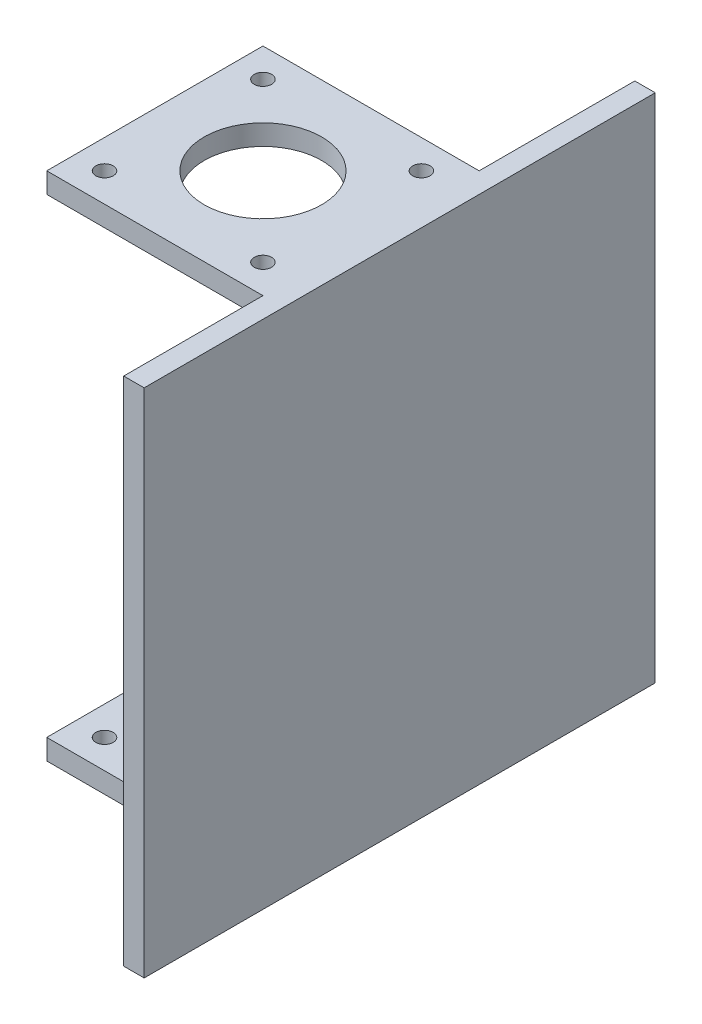
from build123d import *

# Parameters (mm, degrees)
SKETCH2_W           = 42.3
SKETCH2_H           = 42.3
SKETCH2_R           = 1.7
SKETCH2_R_2         = 11.5
BOSS_EXTRUDE1_DEPTH = 4
SKETCH10_W          = 100
SKETCH10_H          = 100
BOSS_EXTRUDE3_DEPTH = 4


with BuildPart() as part:
    # Sketch2 → Boss-Extrude1 (new body)
    with BuildSketch(Plane(origin=(0, 0, 0), x_dir=(1, 0, 0), z_dir=(0, 1, 0))):
        Rectangle(SKETCH2_W, SKETCH2_H)
        with Locations(Location((-15.5, 15.5, 0), (0, 0, 270))):
            Circle(SKETCH2_R, mode=Mode.SUBTRACT)
        with Locations(Location((15.5, 15.5, 0), (0, 0, 270))):
            Circle(SKETCH2_R, mode=Mode.SUBTRACT)
        with Locations(Location((15.5, -15.5, 0), (0, 0, 270))):
            Circle(SKETCH2_R, mode=Mode.SUBTRACT)
        with Locations(Location((-15.5, -15.5, 0), (0, 0, 270))):
            Circle(SKETCH2_R, mode=Mode.SUBTRACT)
        with Locations(Location((0, 0, 0), (0, 0, 270))):
            Circle(SKETCH2_R_2, mode=Mode.SUBTRACT)
    boss_extrude1 = extrude(amount=BOSS_EXTRUDE1_DEPTH)

    # Sketch10 → Boss-Extrude3 (add)
    with BuildSketch(Plane(origin=(21.15, 4, 21.15), x_dir=(0, 0, -1), z_dir=(1, 0, 0))):
        with Locations((22.755859724, -50)):
            Rectangle(SKETCH10_W, SKETCH10_H)
    extrude(amount=BOSS_EXTRUDE3_DEPTH)

    # Mirror1: Boss-Extrude1 across plane
    add(boss_extrude1.mirror(Plane(origin=(0, -46, 0), x_dir=(0, 0, 1), z_dir=(0, -1, 0))))


solid = part.part
